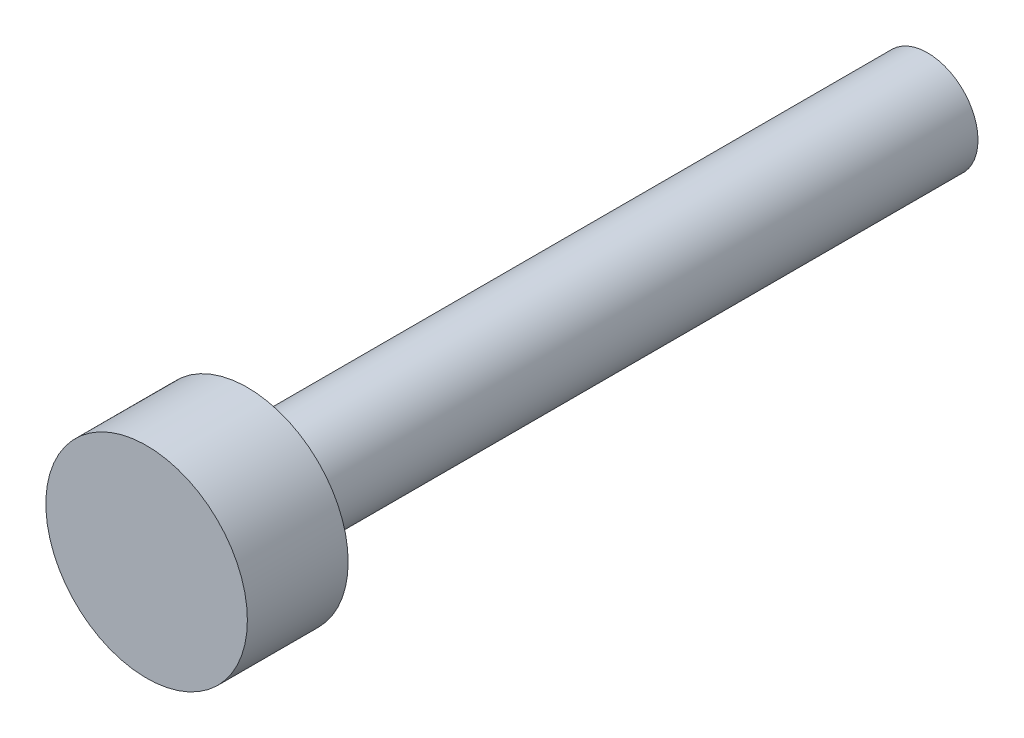
from build123d import *

# Parameters (mm, degrees)
SKETCH_1_R      = 2
EXTRUDE_1_DEPTH = 27
SKETCH_2_R      = 4
EXTRUDE_2_DEPTH = 4


with BuildPart() as part:
    # 草图1 → 凸台-拉伸1 (new body)
    with BuildSketch(Plane.XY):
        Circle(SKETCH_1_R)
    extrude(amount=EXTRUDE_1_DEPTH)

    # 草图2 → 凸台-拉伸2 (add)
    with BuildSketch(Plane.XY.offset(27)):
        Circle(SKETCH_2_R)
    extrude(amount=EXTRUDE_2_DEPTH)


solid = part.part
